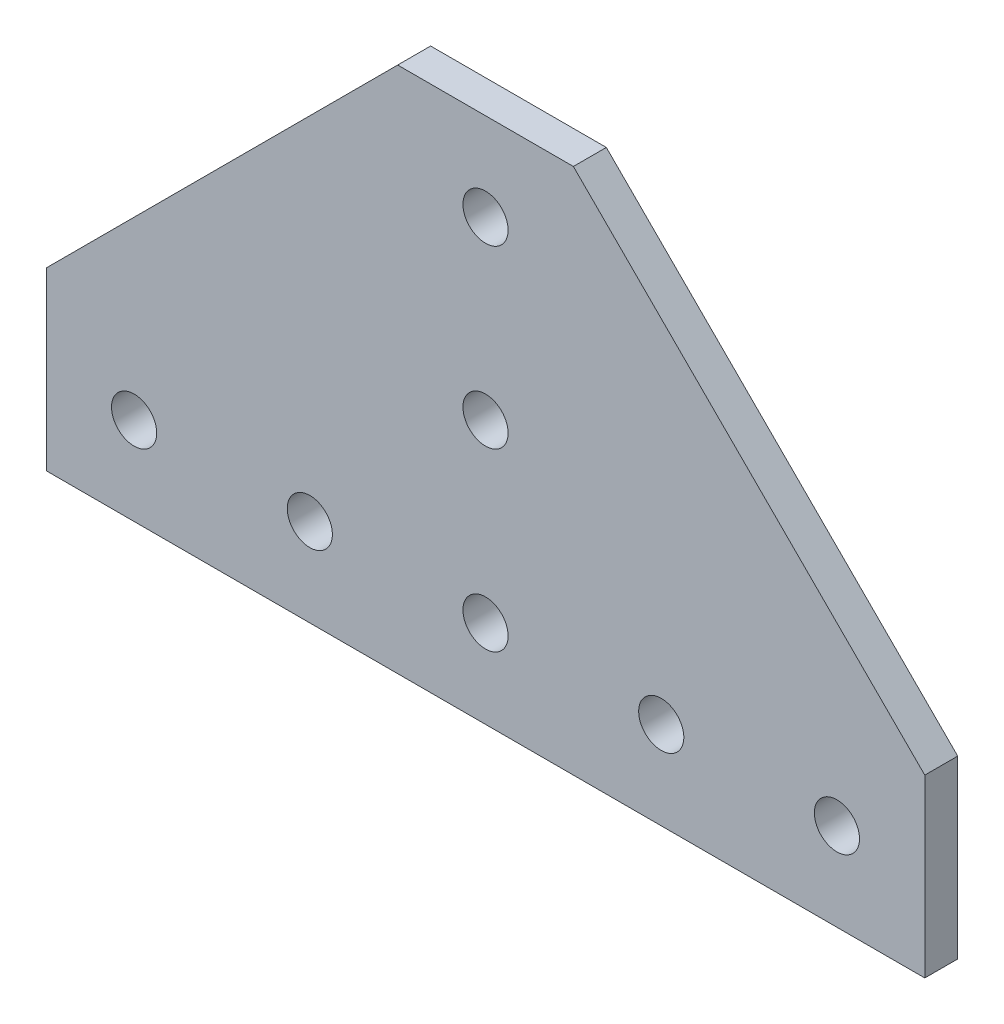
from build123d import *

# Parameters (mm, degrees)
SKETCH1_R           = 3.2639
BOSS_EXTRUDE1_DEPTH = 2.38125


with BuildPart() as part:
    # Sketch1 → Boss-Extrude1 (new, symmetric)
    with BuildSketch(Plane.XY):
        Polygon((76.2, 25.4), (25.4, 76.2), (0, 76.2), (-50.8, 25.4), (-50.8, 0), (0, 0), (76.2, 0), align=None)
        with Locations(Location((12.7, 12.7, 0), (0, 0, 180))):
            Circle(SKETCH1_R, mode=Mode.SUBTRACT)
        with Locations(Location((38.1, 12.7, 0), (0, 0, 180))):
            Circle(SKETCH1_R, mode=Mode.SUBTRACT)
        with Locations(Location((63.5, 12.7, 0), (0, 0, 180))):
            Circle(SKETCH1_R, mode=Mode.SUBTRACT)
        with Locations(Location((12.7, 38.1, 0), (0, 0, 180))):
            Circle(SKETCH1_R, mode=Mode.SUBTRACT)
        with Locations(Location((12.7, 63.5, 0), (0, 0, 180))):
            Circle(SKETCH1_R, mode=Mode.SUBTRACT)
        with Locations(Location((-38.1, 12.7, 0), (0, 0, 180))):
            Circle(SKETCH1_R, mode=Mode.SUBTRACT)
        with Locations(Location((-12.7, 12.7, 0), (0, 0, 180))):
            Circle(SKETCH1_R, mode=Mode.SUBTRACT)
    extrude(amount=BOSS_EXTRUDE1_DEPTH, both=True)


solid = part.part
